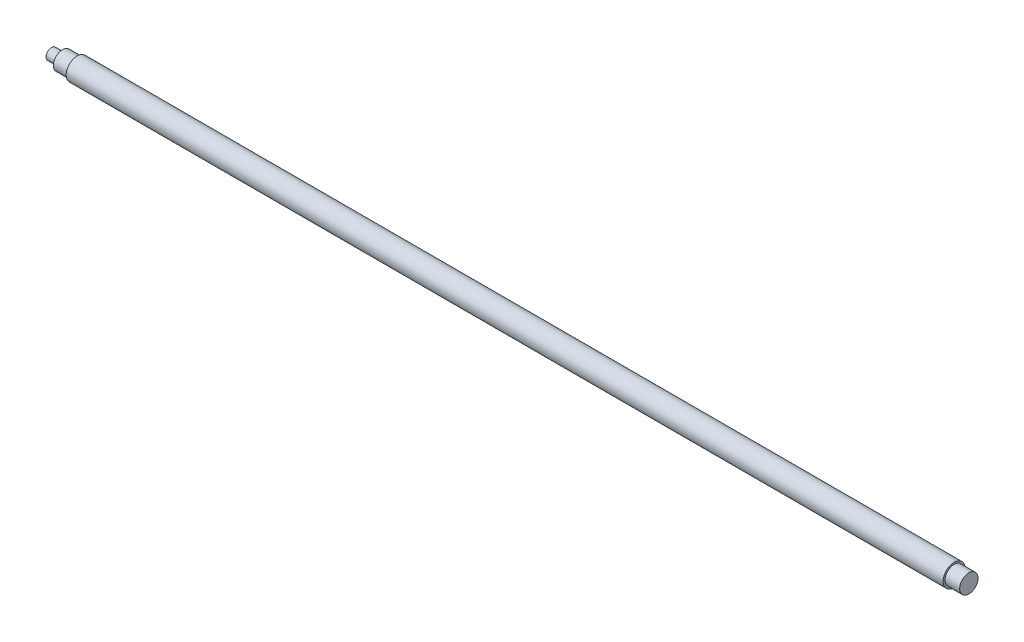
from build123d import *


with BuildPart() as part:
    # Esboço2 → Revolução1 (revolve)
    with BuildSketch(Plane.XY, mode=Mode.PRIVATE) as revolu_o1_sk:
        Polygon((0, 0), (500, 0), (500, 5), (492, 5), (492, 6), (14, 6), (14, 5), (6, 5), (6, 3), (0, 3), align=None)
    revolve(revolu_o1_sk.sketch.rotate(Axis((0, 0, 0), (1, 0, 0)), 90), axis=Axis((0, 0, 0), (1, 0, 0)))


solid = part.part
